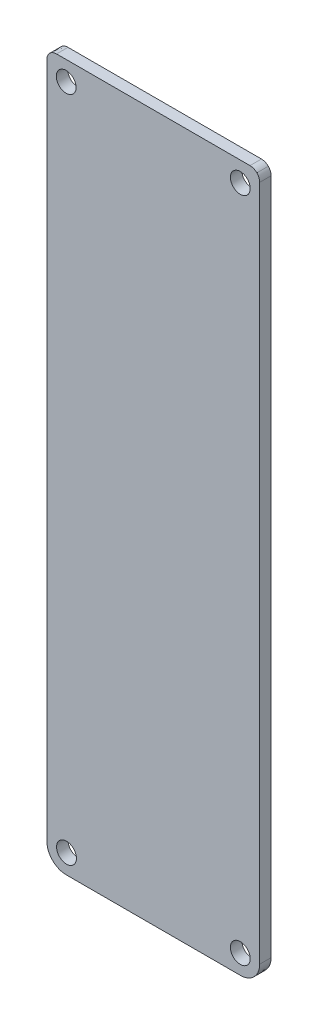
from build123d import *

# Parameters (mm, degrees)
BOSS_EXTRU_1_DEPTH      = 1.5
ESQUISSE2_R             = 1.304771715
ESQUISSE2_R_2           = 1.27
ENL_V_MAT_EXTRU_1_DEPTH = 10
ESQUISSE3_R             = 1.3
ENL_V_MAT_EXTRU_2_DEPTH = 10


with BuildPart() as part:
    # Model → Boss.-Extru.1 (new body)
    with BuildSketch(Plane.XY):
        with BuildLine():
            Line((110.49, -34.813931), (110.49, -38.623931))
            Line((110.49, -38.623931), (110.49, -39.893931))
            Line((110.49, -39.893931), (110.49, -123.713931))
            add(Edge.make_bspline(
                [(109.746051, -125.509982), (110.222394, -125.03364), (110.49, -124.387581), (110.49, -123.713931)],
                knots=[0, 0, 0, 0, 1, 1, 1, 1], degree=3))
            add(Edge.make_bspline(
                [(107.95, -126.253931), (108.62365, -126.253931), (109.269709, -125.986325), (109.746051, -125.509982)],
                knots=[0, 0, 0, 0, 1, 1, 1, 1], degree=3))
            Line((107.95, -126.253931), (85.09, -126.253931))
            add(Edge.make_bspline(
                [(83.293949, -125.509982), (83.770291, -125.986325), (84.41635, -126.253931), (85.09, -126.253931)],
                knots=[0, 0, 0, 0, 1, 1, 1, 1], degree=3))
            add(Edge.make_bspline(
                [(82.55, -123.713931), (82.55, -124.387581), (82.817606, -125.03364), (83.293949, -125.509982)],
                knots=[0, 0, 0, 0, 1, 1, 1, 1], degree=3))
            Line((82.55, -123.713931), (82.55, -39.893931))
            Line((82.55, -39.893931), (82.55, -38.623931))
            Line((82.55, -38.623931), (82.55, -34.813931))
            add(Edge.make_bspline(
                [(82.921974, -33.915905), (82.683803, -34.154076), (82.55, -34.477106), (82.55, -34.813931)],
                knots=[0, 0, 0, 0, 1, 1, 1, 1], degree=3))
            add(Edge.make_bspline(
                [(83.82, -33.543931), (83.483175, -33.543931), (83.160146, -33.677734), (82.921974, -33.915905)],
                knots=[0, 0, 0, 0, 1, 1, 1, 1], degree=3))
            Line((83.82, -33.543931), (109.22, -33.543931))
            add(Edge.make_bspline(
                [(110.118026, -33.915905), (109.879854, -33.677734), (109.556825, -33.543931), (109.22, -33.543931)],
                knots=[0, 0, 0, 0, 1, 1, 1, 1], degree=3))
            add(Edge.make_bspline(
                [(110.49, -34.813931), (110.49, -34.477106), (110.356197, -34.154076), (110.118026, -33.915905)],
                knots=[0, 0, 0, 0, 1, 1, 1, 1], degree=3))
        make_face()
    extrude(amount=BOSS_EXTRU_1_DEPTH)

    # Esquisse2 → Enlèv. mat.-Extru.1 (cut)
    with BuildSketch(Plane.XY.offset(1.5)):
        with Locations((85.124771715, -123.713931)):
            Circle(ESQUISSE2_R)
        with Locations((122.913557923, -132.317690326)):
            Circle(ESQUISSE2_R_2)
    extrude(amount=-ENL_V_MAT_EXTRU_1_DEPTH, mode=Mode.SUBTRACT)

    # Esquisse3 → Enlèv. mat.-Extru.2 (cut)
    with BuildSketch(Plane.XY.offset(1.5)):
        with Locations((107.943434753, -36.148574536)):
            Circle(ESQUISSE3_R)
        with Locations((85.084137325, -36.091280874)):
            Circle(ESQUISSE3_R)
        with Locations((107.943434753, -123.713931)):
            Circle(ESQUISSE3_R)
    extrude(amount=-ENL_V_MAT_EXTRU_2_DEPTH, mode=Mode.SUBTRACT)


solid = part.part
